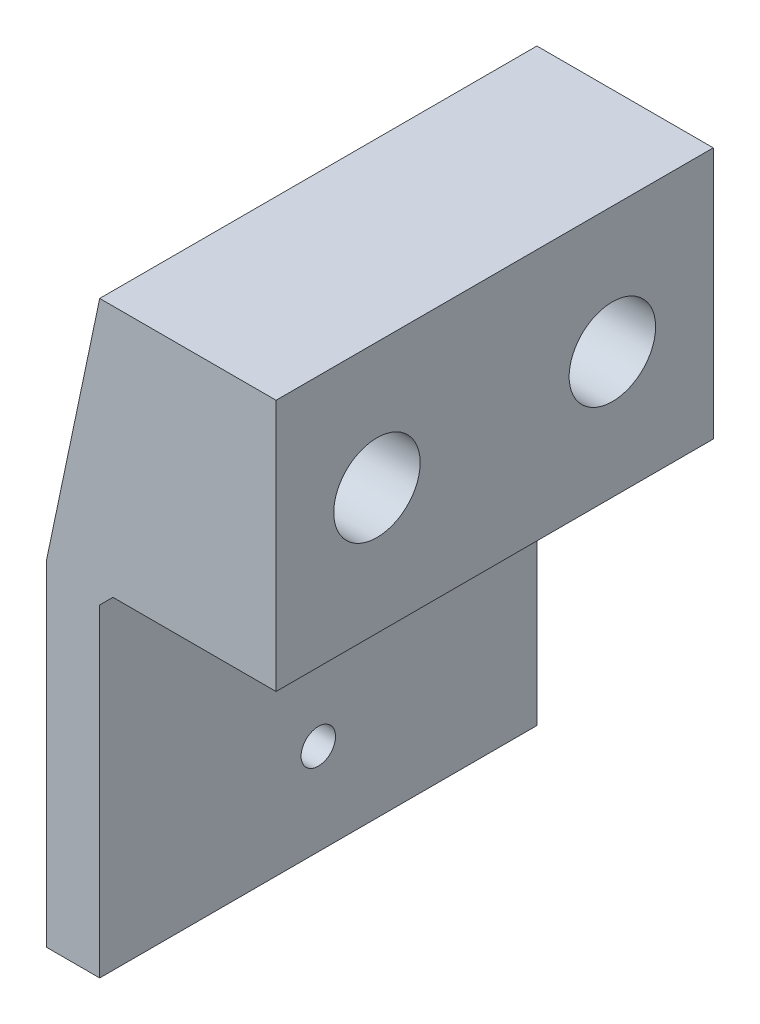
from build123d import *

# Parameters (mm, degrees)
SKETCH1_W                = 33.02
SKETCH1_H                = 25.4
BOSS_EXTRUDE1_DEPTH      = 4
SKETCH2_W                = 33.02
SKETCH2_H                = 19.05
BOSS_EXTRUDE2_DEPTH      = 13.320199928
BOSS_EXTRUDE3_DEPTH      = 33.02
F_0_257_DIAMETER_HOLE1_D = 6.5278
CUT_EXTRUDE1_DEPTH       = 7.62
M2_CLEARANCE_HOLE1_D     = 2.6
CHAMFER1_SIZE            = 1


with BuildPart() as part:
    # Sketch1 → Boss-Extrude1 (new body)
    with BuildSketch(Plane(origin=(0, 0, 0), x_dir=(0, 0, -1), z_dir=(1, 0, 0))):
        with Locations((16.51, -12.7)):
            Rectangle(SKETCH1_W, SKETCH1_H)
    extrude(amount=BOSS_EXTRUDE1_DEPTH)



with BuildPart() as body_2:
    # Sketch2 → Boss-Extrude2 (new body)
    with BuildSketch(Plane(origin=(4, 0, 0), x_dir=(0, 0, -1), z_dir=(1, 0, 0))):
        with Locations((16.51, 9.525)):
            Rectangle(SKETCH2_W, SKETCH2_H)
    extrude(amount=BOSS_EXTRUDE2_DEPTH)


with BuildPart() as part_1:
    add(part.part)

    add(body_2.part)  # Boss-Extrude3 merges body 2
    # Sketch3 → Boss-Extrude3 (add)
    with BuildSketch(Plane.XY):
        Polygon((4, 19.05), (0, 0), (4, 0), align=None)
    extrude(amount=-BOSS_EXTRUDE3_DEPTH)

    # F (0.257) Diameter Hole1 (through all)
    with Locations(Plane(origin=(17.320199928, 0, 0), x_dir=(0, 0, -1), z_dir=(1, 0, 0))):
        with Locations((7.62, 9.525), (25.4, 9.525)):
            Hole(F_0_257_DIAMETER_HOLE1_D / 2)

    # Sketch11 → Cut-Extrude1 (cut)
    with BuildSketch(Plane.ZY):
        with BuildLine():
            Line((-25.4, 15.113), (-7.62, 15.113))
            ThreePointArc((-7.62, 15.113), (-2.032, 9.525), (-7.62, 3.937))
            Line((-7.62, 3.937), (-25.4, 3.937))
            ThreePointArc((-25.4, 3.937), (-30.988, 9.525), (-25.4, 15.113))
        make_face()
    extrude(amount=-CUT_EXTRUDE1_DEPTH, mode=Mode.SUBTRACT)

    # M2 Clearance Hole1 (through all)
    with Locations(Plane.ZY):
        with Locations((-16.51, -6.9), (-16.51, -18.5)):
            Hole(M2_CLEARANCE_HOLE1_D / 2)

    # Chamfer1
    chamfer1_edges = [part_1.edges().sort_by_distance(p)[0] for p in [
        (4, 0, -16.51),
    ]]
    chamfer(chamfer1_edges, length=CHAMFER1_SIZE)


solid = part_1.part
